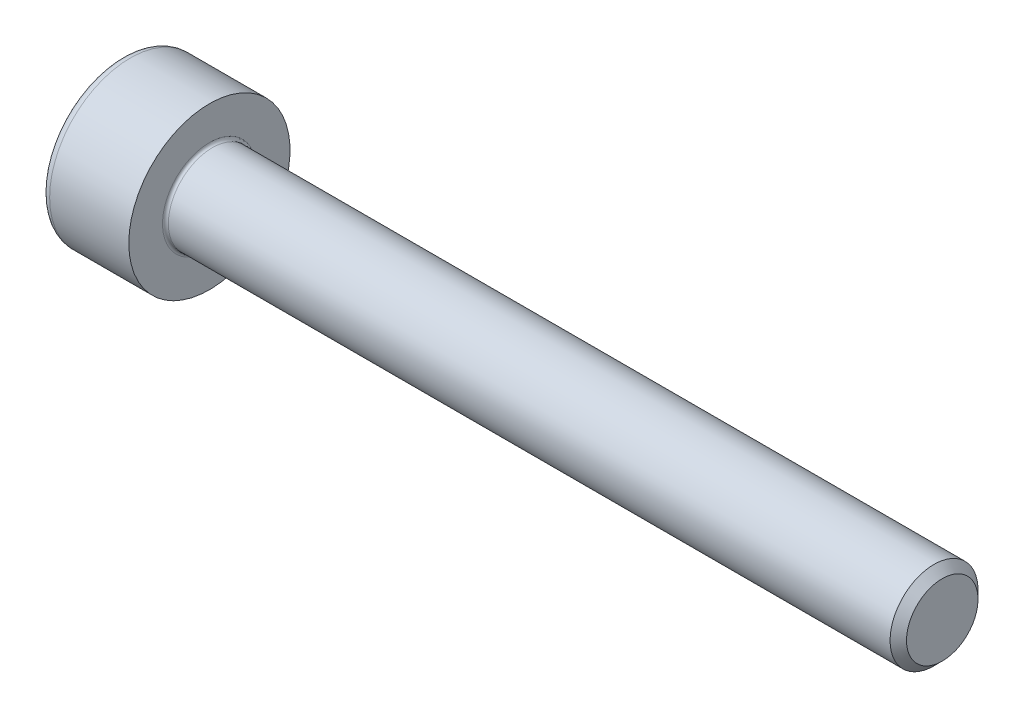
from build123d import *

# Parameters (mm, degrees)
FILLET1_R   = 0.1
FILLET2_R   = 0.3
HEX_2_DEPTH = 1.3


with BuildPart() as part:
    # BodySke → Base-Revolve (revolve)
    with BuildSketch(Plane.XY, mode=Mode.PRIVATE) as base_revolve_sk:
        Polygon((0, 0), (0, 2.75), (3, 2.75), (3, 1.5), (27.7195, 1.5), (28, 1.2195), (28, 0), align=None)
    revolve(base_revolve_sk.sketch.rotate(Axis((-31.75, 0, 0), (1, 0, 0)), 90), axis=Axis((-31.75, 0, 0), (1, 0, 0)))

    # Fillet1
    fillet1_edges = [part.edges().sort_by_distance(p)[0] for p in [
        (3, 0, -1.5),
    ]]
    fillet(fillet1_edges, radius=FILLET1_R)

    # Fillet2
    fillet2_edges = [part.edges().sort_by_distance(p)[0] for p in [
        (0, 0, -2.75),
    ]]
    fillet(fillet2_edges, radius=FILLET2_R)

    # Sketch2 → Hex-PreBroach (revolve, cut)
    with BuildSketch(Plane.XY, mode=Mode.PRIVATE) as hex_prebroach_sk:
        Polygon((0, 1.26), (1.3, 1.26), (2.027461339, 0), (0, 0), align=None)
    revolve(hex_prebroach_sk.sketch.rotate(Axis((0, 0, 0), (1, 0, 0)), 90), axis=Axis((0, 0, 0), (1, 0, 0)), mode=Mode.SUBTRACT)

    # Sketch3 → Hex 2 (cut)
    with BuildSketch(Plane(origin=(0, 0, 0), x_dir=(0, 0.500000000000001, 0.866025403784438), z_dir=(-1, 0, 0))):
        Polygon((0.727461339, 1.26), (-0.727461339, 1.26), (-1.454922678, 0), (-0.727461339, -1.26), (0.727461339, -1.26), (1.454922678, 0), align=None)
    extrude(amount=-HEX_2_DEPTH, mode=Mode.SUBTRACT)


solid = part.part
